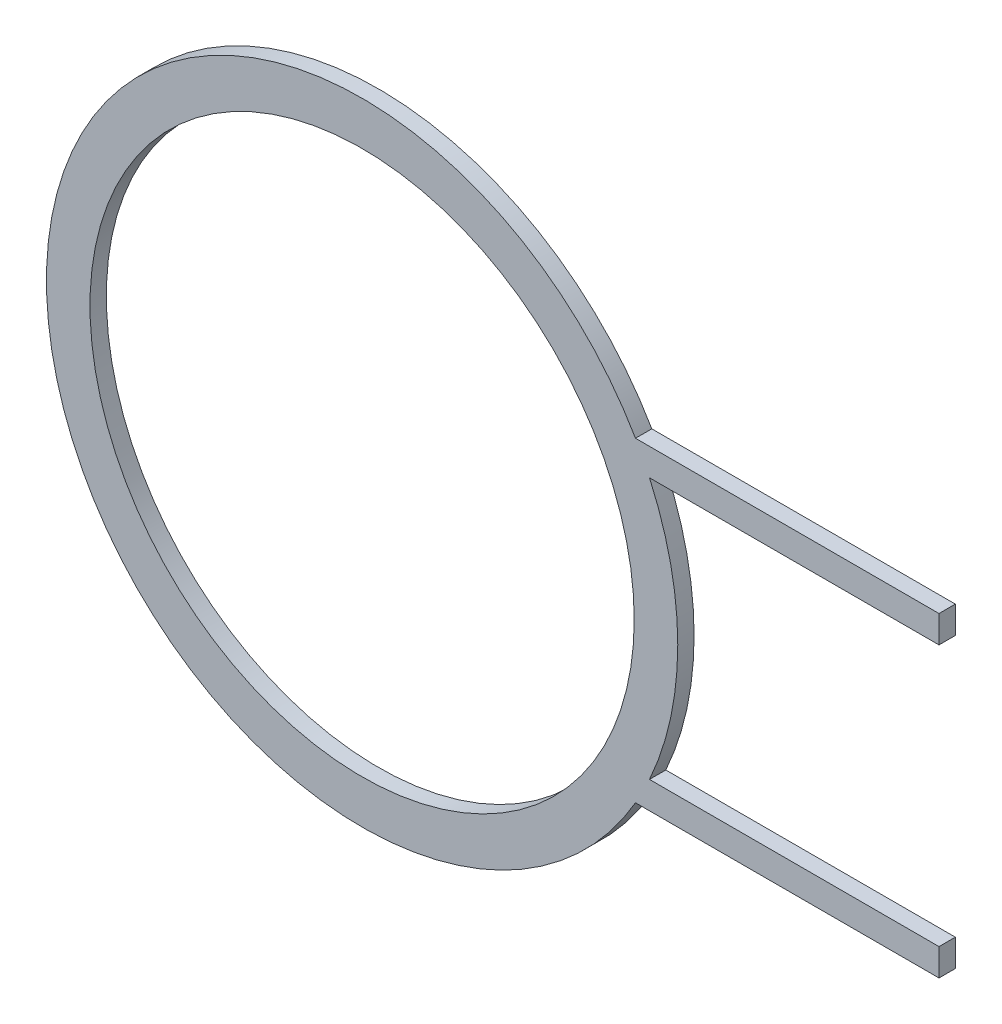
from build123d import *

# Parameters (mm, degrees)
EXTRUDE_1_DEPTH     = 3
SKETCH_5_R          = 50
CUT_EXTRUDE_1_DEPTH = 3


with BuildPart() as part:
    # 草圖1 → 填料-伸長1 (new body)
    with BuildSketch(Plane.XY):
        with BuildLine():
            Line((106, 24), (52.80151513, 24))
            ThreePointArc((52.80151513, 24), (58, 0), (52.80151513, -24))
            Line((52.80151513, -24), (106, -24))
            Line((106, -24), (106, -29))
            Line((106, -29), (50.229473419, -29))
            ThreePointArc((50.229473419, -29), (-58, 0), (50.229473419, 29))
            Line((50.229473419, 29), (106, 29))
            Line((106, 29), (106, 24))
        make_face()
    extrude(amount=EXTRUDE_1_DEPTH)

    # 草圖5 → 除料-伸長1 (cut)
    with BuildSketch(Plane.XY.offset(3)):
        Circle(SKETCH_5_R)
    extrude(amount=-CUT_EXTRUDE_1_DEPTH, mode=Mode.SUBTRACT)


solid = part.part
